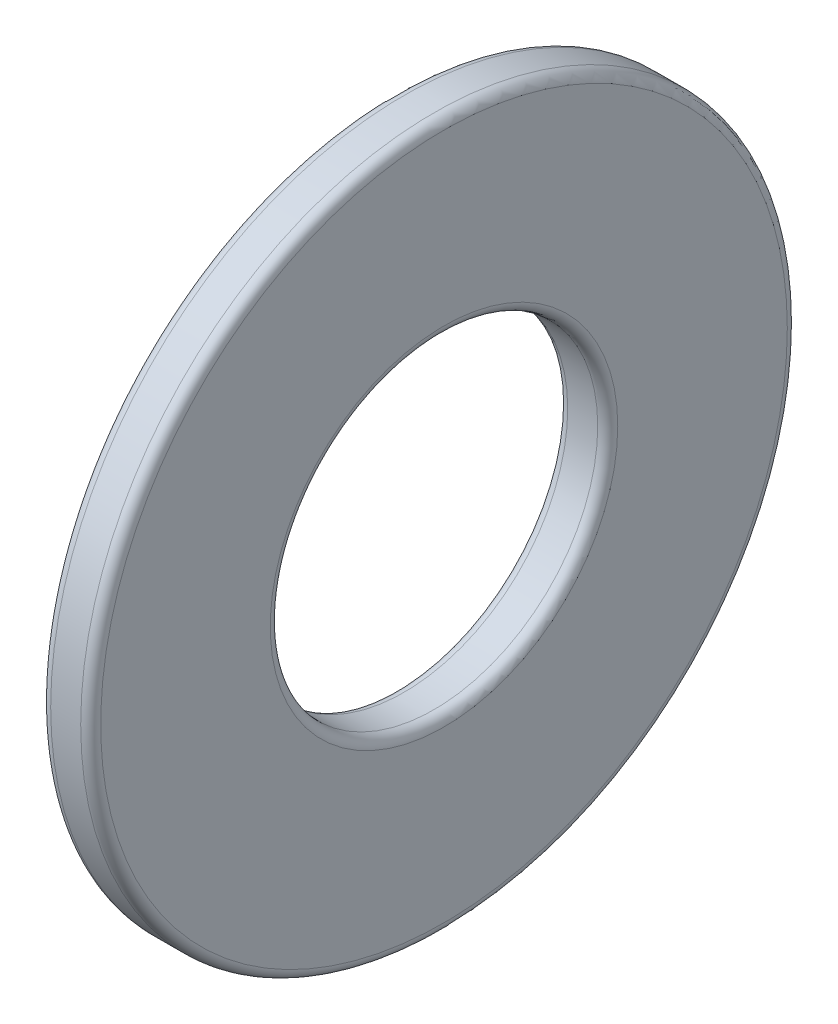
from build123d import *

# Parameters (mm, degrees)
SKETCH1_R           = 5.5626
SKETCH1_R_2         = 2.5781
BOSS_EXTRUDE1_DEPTH = 0.3937
FILLET1_R           = 0.15748


with BuildPart() as part:
    # Sketch1 → Boss-Extrude1 (new, symmetric)
    with BuildSketch(Plane(origin=(0, 0, 0), x_dir=(0, 0, -1), z_dir=(1, 0, 0))):
        Circle(SKETCH1_R)
        Circle(SKETCH1_R_2, mode=Mode.SUBTRACT)
    extrude(amount=BOSS_EXTRUDE1_DEPTH, both=True)

    # Fillet1
    fillet1_edges = [part.edges().sort_by_distance(p)[0] for p in [
        (-0.3937, 0, 5.5626),
        (0.3937, 0, 5.5626),
        (-0.3937, 0, 2.5781),
        (0.3937, 0, 2.5781),
    ]]
    fillet(fillet1_edges, radius=FILLET1_R)


solid = part.part
